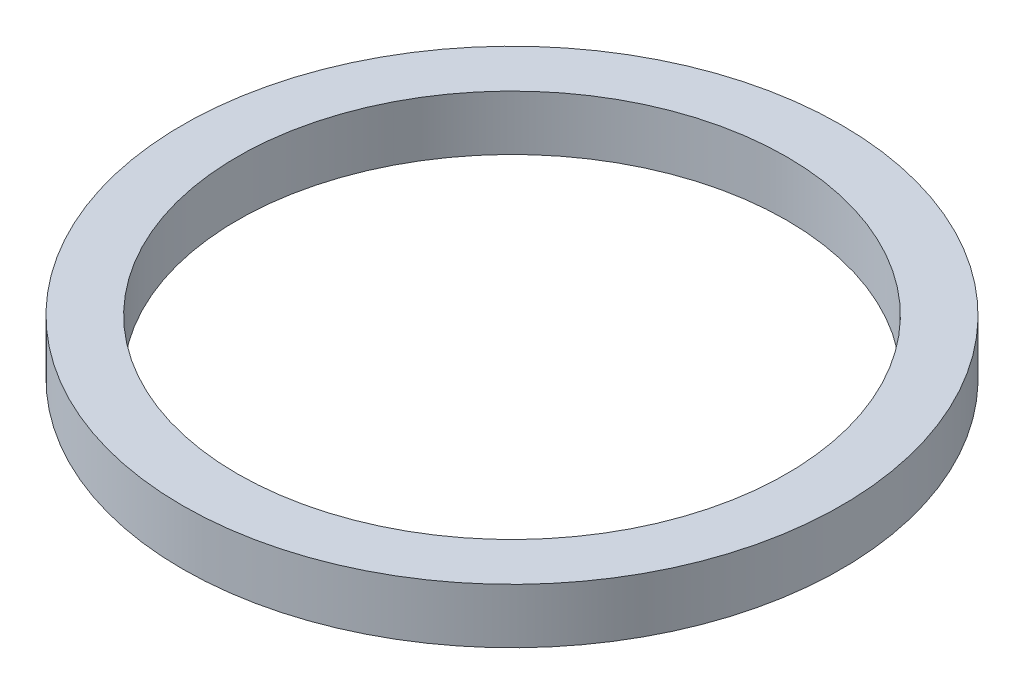
from build123d import *

# Parameters (mm, degrees)
SKETCH1_R           = 6
SKETCH1_R_2         = 5
BOSS_EXTRUDE1_DEPTH = 1


with BuildPart() as part:
    # Sketch1 → Boss-Extrude1 (new body)
    with BuildSketch(Plane(origin=(0, 0, 0), x_dir=(1, 0, 0), z_dir=(0, 1, 0))):
        with Locations(Location((0, 0, 0), (0, 0, 270))):
            Circle(SKETCH1_R)
        with Locations(Location((0, 0, 0), (0, 0, 270))):
            Circle(SKETCH1_R_2, mode=Mode.SUBTRACT)
    extrude(amount=BOSS_EXTRUDE1_DEPTH)


solid = part.part
